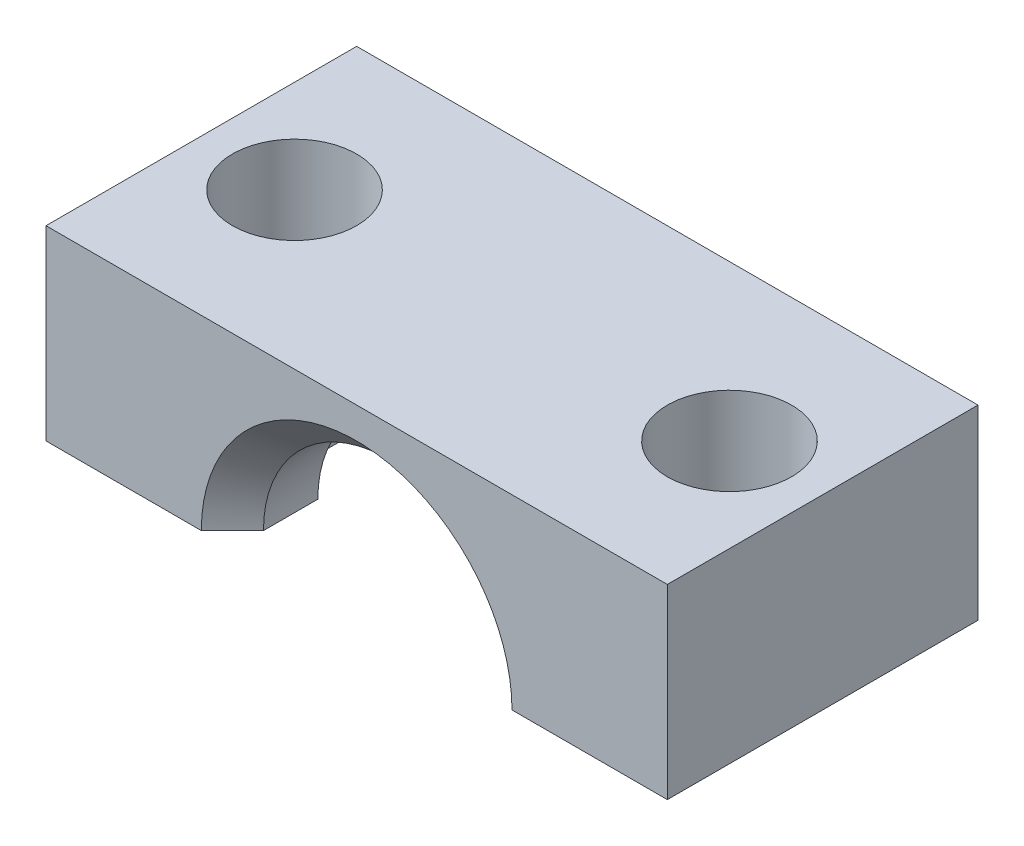
from build123d import *

# Parameters (mm, degrees)
SKETCH_2_W             = 20
SKETCH_2_H             = 6
EXTRUDE_379_DEPTH      = 5
SKETCH_3_R             = 4
CUT_EXTRUDE_526_DEPTH  = 16.362291496
SKETCH_4_R             = 5.25
CUT_EXTRUDE_602_DEPTH  = 2.25
SKETCH_5_R             = 1.2
CUT_EXTRUDE_755_DEPTH  = 13.68857754
CHAMFER_2_SIZE         = 1
SKETCH_6_R             = 2
CUT_EXTRUDE_1018_DEPTH = 4


with BuildPart() as part:
    # Эскиз2 → Extrude 379 (new, symmetric)
    with BuildSketch(Plane.XY):
        with Locations((0, 3)):
            Rectangle(SKETCH_2_W, SKETCH_2_H)
    extrude(amount=EXTRUDE_379_DEPTH, both=True)

    # Эскиз3 → Cut-Extrude 526 (cut, through all)
    with BuildSketch(Plane.XY.offset(5)):
        Circle(SKETCH_3_R)
    extrude(amount=-CUT_EXTRUDE_526_DEPTH, mode=Mode.SUBTRACT)

    # Эскиз4 → Cut-Extrude 602 (cut, symmetric)
    with BuildSketch(Plane.XY):
        Circle(SKETCH_4_R)
    extrude(amount=CUT_EXTRUDE_602_DEPTH, both=True, mode=Mode.SUBTRACT)

    # Эскиз5 → Cut-Extrude 755 (cut, through all)
    with BuildSketch(Plane(origin=(0, 6, 0), x_dir=(1, 0, 0), z_dir=(0, 1, 0))):
        with Locations(Location((-7, 0, 0), (0, 0, 270))):
            Circle(SKETCH_5_R)
        with Locations(Location((7, 0, 0), (0, 0, 270))):
            Circle(SKETCH_5_R)
    extrude(amount=-CUT_EXTRUDE_755_DEPTH, mode=Mode.SUBTRACT)

    # Фаска2
    chamfer_2_edges = [part.edges().sort_by_distance(p)[0] for p in [
        (0, 4, 5),
        (0, 4, -5),
    ]]
    chamfer(chamfer_2_edges, length=CHAMFER_2_SIZE)

    # Эскиз6 → Cut-Extrude 1018 (cut)
    with BuildSketch(Plane(origin=(0, 6, 0), x_dir=(1, 0, 0), z_dir=(0, 1, 0))):
        with Locations(Location((-7, 0, 0), (0, 0, 270))):
            Circle(SKETCH_6_R)
        with Locations(Location((7, 0, 0), (0, 0, 270))):
            Circle(SKETCH_6_R)
    extrude(amount=-CUT_EXTRUDE_1018_DEPTH, mode=Mode.SUBTRACT)


solid = part.part
